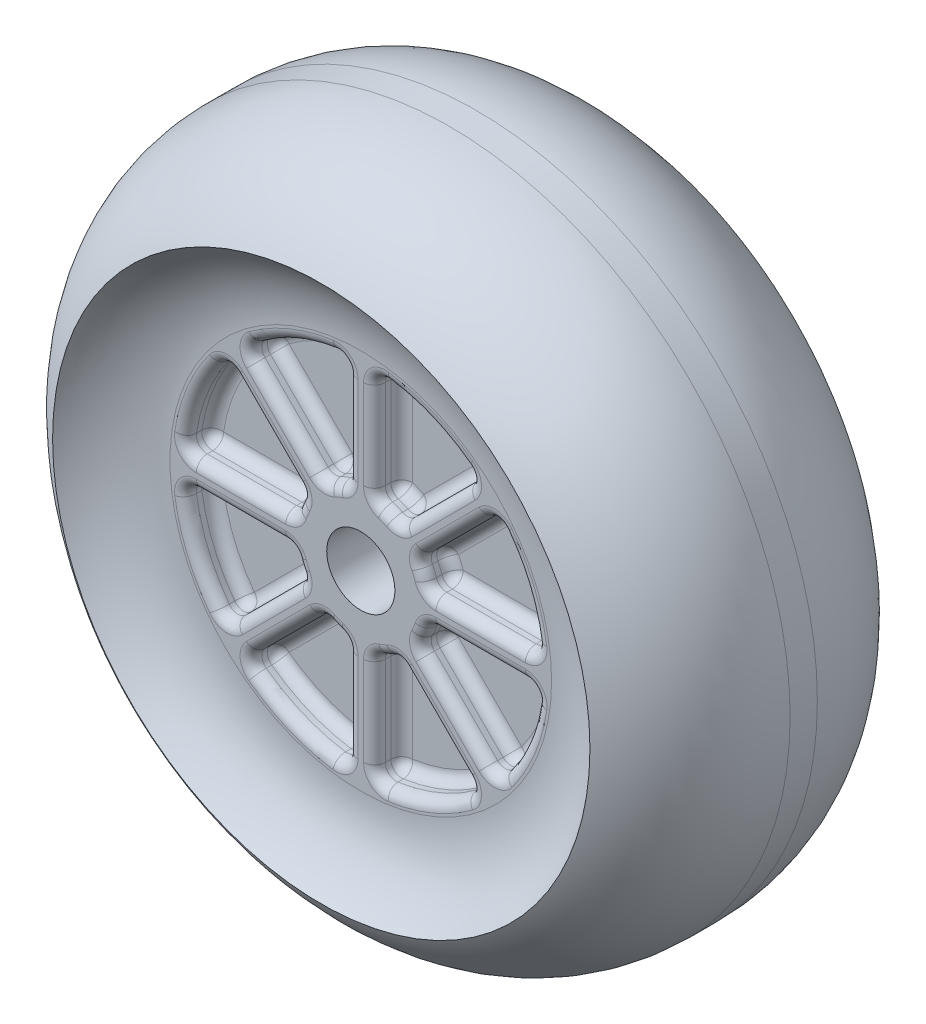
from build123d import *

# Parameters (mm, degrees)
SKETCH1_R           = 8.89
SKETCH1_R_2         = 3.175
BOSS_EXTRUDE2_DEPTH = 4.7625
SKETCH1_4_R         = 15.875
SKETCH1_4_R_2       = 8.89
BOSS_EXTRUDE3_DEPTH = 0.635
SKETCH1_5_R         = 3.175
SKETCH1_5_R_2       = 1.5875
BOSS_EXTRUDE4_DEPTH = 4.7625
CUT_EXTRUDE2_START  = 3.4925
CUT_EXTRUDE2_DEPTH  = 1.27
CUT_EXTRUDE3_START  = -4.7625
CUT_EXTRUDE3_DEPTH  = 1.27
FILLET2_R           = 0.508


with BuildPart() as part:
    # Sketch1 → Boss-Extrude2 (new, symmetric)
    with BuildSketch(Plane.XY):
        with Locations(Location((0, 0, 0), (0, 0, 180))):
            Circle(SKETCH1_R)
        with Locations(Location((0, 0, 0), (0, 0, 180))):
            Circle(SKETCH1_R_2, mode=Mode.SUBTRACT)
    extrude(amount=BOSS_EXTRUDE2_DEPTH, both=True)

    # Sketch1<4> → Boss-Extrude3 (add, symmetric)
    with BuildSketch(Plane.XY):
        Circle(SKETCH1_4_R)
        with Locations(Location((0, 0, 0), (0, 0, 180))):
            Circle(SKETCH1_4_R_2, mode=Mode.SUBTRACT)
    extrude(amount=BOSS_EXTRUDE3_DEPTH, both=True)

    # Sketch1<5> → Boss-Extrude4 (add, symmetric)
    with BuildSketch(Plane.XY):
        Circle(SKETCH1_5_R)
        with Locations(Location((0, 0, 0), (0, 0, 180))):
            Circle(SKETCH1_5_R_2, mode=Mode.SUBTRACT)
    extrude(amount=BOSS_EXTRUDE4_DEPTH, both=True)

    # Sketch2 → Cut-Extrude2 (cut)
    with BuildSketch(Plane.XY.offset(CUT_EXTRUDE2_START)):
        with BuildLine():
            Line((-0.635, 3.110851973), (-0.635, 8.230540687))
            ThreePointArc((-0.635, 8.230540687), (-3.159051734, 7.626625541), (-5.370858327, 6.268883939))
            Line((-5.370858327, 6.268883939), (-1.75069172, 2.648717332))
            ThreePointArc((-1.75069172, 2.648717332), (-1.215019898, 2.933317516), (-0.635, 3.110851973))
        make_face()
        with BuildLine():
            Line((0.635, 8.230540687), (0.635, 3.110851973))
            ThreePointArc((0.635, 3.110851973), (1.215019898, 2.933317516), (1.75069172, 2.648717332))
            Line((1.75069172, 2.648717332), (5.370858327, 6.268883939))
            ThreePointArc((5.370858327, 6.268883939), (3.159051734, 7.626625541), (0.635, 8.230540687))
        make_face()
        with BuildLine():
            Line((6.268883939, 5.370858327), (2.648717332, 1.75069172))
            ThreePointArc((2.648717332, 1.75069172), (2.933317516, 1.215019898), (3.110851973, 0.635))
            Line((3.110851973, 0.635), (8.230540687, 0.635))
            ThreePointArc((8.230540687, 0.635), (7.626625541, 3.159051734), (6.268883939, 5.370858327))
        make_face()
        with BuildLine():
            Line((8.230540687, -0.635), (3.110851973, -0.635))
            ThreePointArc((3.110851973, -0.635), (2.933317516, -1.215019898), (2.648717332, -1.75069172))
            Line((2.648717332, -1.75069172), (6.268883939, -5.370858327))
            ThreePointArc((6.268883939, -5.370858327), (7.626625541, -3.159051734), (8.230540687, -0.635))
        make_face()
        with BuildLine():
            Line((5.370858327, -6.268883939), (1.75069172, -2.648717332))
            ThreePointArc((1.75069172, -2.648717332), (1.215019898, -2.933317516), (0.635, -3.110851973))
            Line((0.635, -3.110851973), (0.635, -8.230540687))
            ThreePointArc((0.635, -8.230540687), (3.159051734, -7.626625541), (5.370858327, -6.268883939))
        make_face()
        with BuildLine():
            Line((-0.635, -8.230540687), (-0.635, -3.110851973))
            ThreePointArc((-0.635, -3.110851973), (-1.215019898, -2.933317516), (-1.75069172, -2.648717332))
            Line((-1.75069172, -2.648717332), (-5.370858327, -6.268883939))
            ThreePointArc((-5.370858327, -6.268883939), (-3.159051734, -7.626625541), (-0.635, -8.230540687))
        make_face()
        with BuildLine():
            Line((-6.268883939, -5.370858327), (-2.648717332, -1.75069172))
            ThreePointArc((-2.648717332, -1.75069172), (-2.933317516, -1.215019898), (-3.110851973, -0.635))
            Line((-3.110851973, -0.635), (-8.230540687, -0.635))
            ThreePointArc((-8.230540687, -0.635), (-7.626625541, -3.159051734), (-6.268883939, -5.370858327))
        make_face()
        with BuildLine():
            Line((-8.230540687, 0.635), (-3.110851973, 0.635))
            ThreePointArc((-3.110851973, 0.635), (-2.933317516, 1.215019898), (-2.648717332, 1.75069172))
            Line((-2.648717332, 1.75069172), (-6.268883939, 5.370858327))
            ThreePointArc((-6.268883939, 5.370858327), (-7.626625541, 3.159051734), (-8.230540687, 0.635))
        make_face()
    extrude(amount=CUT_EXTRUDE2_DEPTH, mode=Mode.SUBTRACT)

    # Sketch2<2> → Cut-Extrude3 (cut)
    with BuildSketch(Plane.XY.offset(CUT_EXTRUDE3_START)):
        with BuildLine():
            Line((-0.635, 3.110851973), (-0.635, 8.230540687))
            ThreePointArc((-0.635, 8.230540687), (-3.159051734, 7.626625541), (-5.370858327, 6.268883939))
            Line((-5.370858327, 6.268883939), (-1.75069172, 2.648717332))
            ThreePointArc((-1.75069172, 2.648717332), (-1.215019898, 2.933317516), (-0.635, 3.110851973))
        make_face()
        with BuildLine():
            Line((0.635, 8.230540687), (0.635, 3.110851973))
            ThreePointArc((0.635, 3.110851973), (1.215019898, 2.933317516), (1.75069172, 2.648717332))
            Line((1.75069172, 2.648717332), (5.370858327, 6.268883939))
            ThreePointArc((5.370858327, 6.268883939), (3.159051734, 7.626625541), (0.635, 8.230540687))
        make_face()
        with BuildLine():
            Line((6.268883939, 5.370858327), (2.648717332, 1.75069172))
            ThreePointArc((2.648717332, 1.75069172), (2.933317516, 1.215019898), (3.110851973, 0.635))
            Line((3.110851973, 0.635), (8.230540687, 0.635))
            ThreePointArc((8.230540687, 0.635), (7.626625541, 3.159051734), (6.268883939, 5.370858327))
        make_face()
        with BuildLine():
            Line((8.230540687, -0.635), (3.110851973, -0.635))
            ThreePointArc((3.110851973, -0.635), (2.933317516, -1.215019898), (2.648717332, -1.75069172))
            Line((2.648717332, -1.75069172), (6.268883939, -5.370858327))
            ThreePointArc((6.268883939, -5.370858327), (7.626625541, -3.159051734), (8.230540687, -0.635))
        make_face()
        with BuildLine():
            Line((5.370858327, -6.268883939), (1.75069172, -2.648717332))
            ThreePointArc((1.75069172, -2.648717332), (1.215019898, -2.933317516), (0.635, -3.110851973))
            Line((0.635, -3.110851973), (0.635, -8.230540687))
            ThreePointArc((0.635, -8.230540687), (3.159051734, -7.626625541), (5.370858327, -6.268883939))
        make_face()
        with BuildLine():
            Line((-0.635, -8.230540687), (-0.635, -3.110851973))
            ThreePointArc((-0.635, -3.110851973), (-1.215019898, -2.933317516), (-1.75069172, -2.648717332))
            Line((-1.75069172, -2.648717332), (-5.370858327, -6.268883939))
            ThreePointArc((-5.370858327, -6.268883939), (-3.159051734, -7.626625541), (-0.635, -8.230540687))
        make_face()
        with BuildLine():
            Line((-6.268883939, -5.370858327), (-2.648717332, -1.75069172))
            ThreePointArc((-2.648717332, -1.75069172), (-2.933317516, -1.215019898), (-3.110851973, -0.635))
            Line((-3.110851973, -0.635), (-8.230540687, -0.635))
            ThreePointArc((-8.230540687, -0.635), (-7.626625541, -3.159051734), (-6.268883939, -5.370858327))
        make_face()
        with BuildLine():
            Line((-8.230540687, 0.635), (-3.110851973, 0.635))
            ThreePointArc((-3.110851973, 0.635), (-2.933317516, 1.215019898), (-2.648717332, 1.75069172))
            Line((-2.648717332, 1.75069172), (-6.268883939, 5.370858327))
            ThreePointArc((-6.268883939, 5.370858327), (-7.626625541, 3.159051734), (-8.230540687, 0.635))
        make_face()
    extrude(amount=CUT_EXTRUDE3_DEPTH, mode=Mode.SUBTRACT)

    # Sketch3 → Revolve1 (revolve)
    with BuildSketch(Plane(origin=(0, 0, 0), x_dir=(0, 0, -1), z_dir=(1, 0, 0)), mode=Mode.PRIVATE) as revolve1_sk:
        with BuildLine():
            Line((0.635, 15.875), (0.635, 8.89))
            Line((0.635, 8.89), (4.7625, 8.89))
            ThreePointArc((4.7625, 8.89), (5.249129815, 10.924397225), (6.60367268, 12.518384135))
            ThreePointArc((6.60367268, 12.518384135), (4.058883892, 14.978287452), (0.635, 15.875))
        make_face()
        with BuildLine():
            Line((-0.635, 8.89), (-4.7625, 8.89))
            ThreePointArc((-4.7625, 8.89), (-5.249129815, 10.924397225), (-6.60367268, 12.518384135))
            ThreePointArc((-6.60367268, 12.518384135), (-4.058883892, 14.978287452), (-0.635, 15.875))
            Line((-0.635, 15.875), (-0.635, 8.89))
        make_face()
    revolve(revolve1_sk.sketch.rotate(Axis((0, 0, 4.7625), (0, 0, -1)), 90), axis=Axis((0, 0, 4.7625), (0, 0, -1)))

    # Fillet2
    fillet2_edges = [part.edges().sort_by_distance(p)[0] for p in [
        (-2.933317516, 1.215019898, -3.4925),
        (-3.110851973, 0.635, -4.1275),
        (-4.458800635, 3.560775023, -4.7625),
        (-2.648717332, 1.75069172, -4.1275),
        (-7.626625541, 3.159051734, -4.7625),
        (-6.268883939, 5.370858327, -4.1275),
        (-5.67069633, 0.635, -4.7625),
        (-8.230540687, 0.635, -4.1275),
        (-4.458800635, 3.560775023, -3.4925),
        (-7.626625541, 3.159051734, -3.4925),
        (-5.67069633, 0.635, -3.4925),
        (-2.933317516, 1.215019898, -4.7625),
        (-1.215019898, -2.933317516, -3.4925),
        (-0.635, -3.110851973, -4.1275),
        (-3.560775023, -4.458800635, -4.7625),
        (-1.75069172, -2.648717332, -4.1275),
        (-3.159051734, -7.626625541, -4.7625),
        (-5.370858327, -6.268883939, -4.1275),
        (-0.635, -5.67069633, -4.7625),
        (-0.635, -8.230540687, -4.1275),
        (-3.560775023, -4.458800635, -3.4925),
        (-3.159051734, -7.626625541, -3.4925),
        (-0.635, -5.67069633, -3.4925),
        (-1.215019898, -2.933317516, -4.7625),
        (-2.933317516, -1.215019898, -3.4925),
        (-2.648717332, -1.75069172, -4.1275),
        (-5.67069633, -0.635, -4.7625),
        (-3.110851973, -0.635, -4.1275),
        (-7.626625541, -3.159051734, -4.7625),
        (-8.230540687, -0.635, -4.1275),
        (-4.458800635, -3.560775023, -4.7625),
        (-6.268883939, -5.370858327, -4.1275),
        (-5.67069633, -0.635, -3.4925),
        (-7.626625541, -3.159051734, -3.4925),
        (-4.458800635, -3.560775023, -3.4925),
        (-2.933317516, -1.215019898, -4.7625),
        (2.933317516, -1.215019898, -3.4925),
        (3.110851973, -0.635, -4.1275),
        (4.458800635, -3.560775023, -4.7625),
        (2.648717332, -1.75069172, -4.1275),
        (7.626625541, -3.159051734, -4.7625),
        (6.268883939, -5.370858327, -4.1275),
        (5.67069633, -0.635, -4.7625),
        (8.230540687, -0.635, -4.1275),
        (4.458800635, -3.560775023, -3.4925),
        (7.626625541, -3.159051734, -3.4925),
        (5.67069633, -0.635, -3.4925),
        (2.933317516, -1.215019898, -4.7625),
        (1.215019898, -2.933317516, -3.4925),
        (1.75069172, -2.648717332, -4.1275),
        (0.635, -5.67069633, -4.7625),
        (0.635, -3.110851973, -4.1275),
        (3.159051734, -7.626625541, -4.7625),
        (0.635, -8.230540687, -4.1275),
        (3.560775023, -4.458800635, -4.7625),
        (5.370858327, -6.268883939, -4.1275),
        (0.635, -5.67069633, -3.4925),
        (3.159051734, -7.626625541, -3.4925),
        (3.560775023, -4.458800635, -3.4925),
        (1.215019898, -2.933317516, -4.7625),
        (1.215019898, 2.933317516, -3.4925),
        (0.635, 3.110851973, -4.1275),
        (3.560775023, 4.458800635, -4.7625),
        (1.75069172, 2.648717332, -4.1275),
        (3.159051734, 7.626625541, -4.7625),
        (5.370858327, 6.268883939, -4.1275),
        (0.635, 5.67069633, -4.7625),
        (0.635, 8.230540687, -4.1275),
        (3.560775023, 4.458800635, -3.4925),
        (3.159051734, 7.626625541, -3.4925),
        (0.635, 5.67069633, -3.4925),
        (1.215019898, 2.933317516, -4.7625),
        (2.933317516, 1.215019898, -3.4925),
        (2.648717332, 1.75069172, -4.1275),
        (5.67069633, 0.635, -4.7625),
        (3.110851973, 0.635, -4.1275),
        (7.626625541, 3.159051734, -4.7625),
        (8.230540687, 0.635, -4.1275),
        (4.458800635, 3.560775023, -4.7625),
        (6.268883939, 5.370858327, -4.1275),
        (5.67069633, 0.635, -3.4925),
        (7.626625541, 3.159051734, -3.4925),
        (4.458800635, 3.560775023, -3.4925),
        (2.933317516, 1.215019898, -4.7625),
        (-1.215019898, 2.933317516, -3.4925),
        (-1.75069172, 2.648717332, -4.1275),
        (-0.635, 5.67069633, -4.7625),
        (-0.635, 3.110851973, -4.1275),
        (-3.159051734, 7.626625541, -4.7625),
        (-0.635, 8.230540687, -4.1275),
        (-3.560775023, 4.458800635, -4.7625),
        (-5.370858327, 6.268883939, -4.1275),
        (-0.635, 5.67069633, -3.4925),
        (-3.159051734, 7.626625541, -3.4925),
        (-3.560775023, 4.458800635, -3.4925),
        (-1.215019898, 2.933317516, -4.7625),
        (-2.933317516, 1.215019898, 4.7625),
        (-2.648717332, 1.75069172, 4.1275),
        (-5.67069633, 0.635, 4.7625),
        (-3.110851973, 0.635, 4.1275),
        (-7.626625541, 3.159051734, 3.4925),
        (-8.230540687, 0.635, 4.1275),
        (-4.458800635, 3.560775023, 4.7625),
        (-6.268883939, 5.370858327, 4.1275),
        (-2.933317516, 1.215019898, 3.4925),
        (-5.67069633, 0.635, 3.4925),
        (-4.458800635, 3.560775023, 3.4925),
        (-7.626625541, 3.159051734, 4.7625),
        (-1.215019898, -2.933317516, 4.7625),
        (-1.75069172, -2.648717332, 4.1275),
        (-0.635, -5.67069633, 4.7625),
        (-0.635, -3.110851973, 4.1275),
        (-3.159051734, -7.626625541, 3.4925),
        (-0.635, -8.230540687, 4.1275),
        (-3.560775023, -4.458800635, 4.7625),
        (-5.370858327, -6.268883939, 4.1275),
        (-1.215019898, -2.933317516, 3.4925),
        (-0.635, -5.67069633, 3.4925),
        (-3.560775023, -4.458800635, 3.4925),
        (-3.159051734, -7.626625541, 4.7625),
        (-2.933317516, -1.215019898, 4.7625),
        (-3.110851973, -0.635, 4.1275),
        (-4.458800635, -3.560775023, 4.7625),
        (-2.648717332, -1.75069172, 4.1275),
        (-7.626625541, -3.159051734, 3.4925),
        (-6.268883939, -5.370858327, 4.1275),
        (-5.67069633, -0.635, 4.7625),
        (-8.230540687, -0.635, 4.1275),
        (-2.933317516, -1.215019898, 3.4925),
        (-4.458800635, -3.560775023, 3.4925),
        (-5.67069633, -0.635, 3.4925),
        (-7.626625541, -3.159051734, 4.7625),
        (2.933317516, -1.215019898, 4.7625),
        (2.648717332, -1.75069172, 4.1275),
        (5.67069633, -0.635, 4.7625),
        (3.110851973, -0.635, 4.1275),
        (7.626625541, -3.159051734, 3.4925),
        (8.230540687, -0.635, 4.1275),
        (4.458800635, -3.560775023, 4.7625),
        (6.268883939, -5.370858327, 4.1275),
        (2.933317516, -1.215019898, 3.4925),
        (5.67069633, -0.635, 3.4925),
        (4.458800635, -3.560775023, 3.4925),
        (7.626625541, -3.159051734, 4.7625),
        (1.215019898, -2.933317516, 4.7625),
        (0.635, -3.110851973, 4.1275),
        (3.560775023, -4.458800635, 4.7625),
        (1.75069172, -2.648717332, 4.1275),
        (3.159051734, -7.626625541, 3.4925),
        (5.370858327, -6.268883939, 4.1275),
        (0.635, -5.67069633, 4.7625),
        (0.635, -8.230540687, 4.1275),
        (1.215019898, -2.933317516, 3.4925),
        (3.560775023, -4.458800635, 3.4925),
        (0.635, -5.67069633, 3.4925),
        (3.159051734, -7.626625541, 4.7625),
        (1.215019898, 2.933317516, 4.7625),
        (1.75069172, 2.648717332, 4.1275),
        (0.635, 5.67069633, 4.7625),
        (0.635, 3.110851973, 4.1275),
        (3.159051734, 7.626625541, 3.4925),
        (0.635, 8.230540687, 4.1275),
        (3.560775023, 4.458800635, 4.7625),
        (5.370858327, 6.268883939, 4.1275),
        (1.215019898, 2.933317516, 3.4925),
        (0.635, 5.67069633, 3.4925),
        (3.560775023, 4.458800635, 3.4925),
        (3.159051734, 7.626625541, 4.7625),
        (2.933317516, 1.215019898, 4.7625),
        (3.110851973, 0.635, 4.1275),
        (4.458800635, 3.560775023, 4.7625),
        (2.648717332, 1.75069172, 4.1275),
        (7.626625541, 3.159051734, 3.4925),
        (6.268883939, 5.370858327, 4.1275),
        (5.67069633, 0.635, 4.7625),
        (8.230540687, 0.635, 4.1275),
        (2.933317516, 1.215019898, 3.4925),
        (4.458800635, 3.560775023, 3.4925),
        (5.67069633, 0.635, 3.4925),
        (7.626625541, 3.159051734, 4.7625),
        (-1.215019898, 2.933317516, 4.7625),
        (-0.635, 3.110851973, 4.1275),
        (-3.560775023, 4.458800635, 4.7625),
        (-1.75069172, 2.648717332, 4.1275),
        (-3.159051734, 7.626625541, 3.4925),
        (-5.370858327, 6.268883939, 4.1275),
        (-0.635, 5.67069633, 4.7625),
        (-0.635, 8.230540687, 4.1275),
        (-1.215019898, 2.933317516, 3.4925),
        (-3.560775023, 4.458800635, 3.4925),
        (-0.635, 5.67069633, 3.4925),
        (-3.159051734, 7.626625541, 4.7625),
    ]]
    fillet(fillet2_edges, radius=FILLET2_R)


solid = part.part
